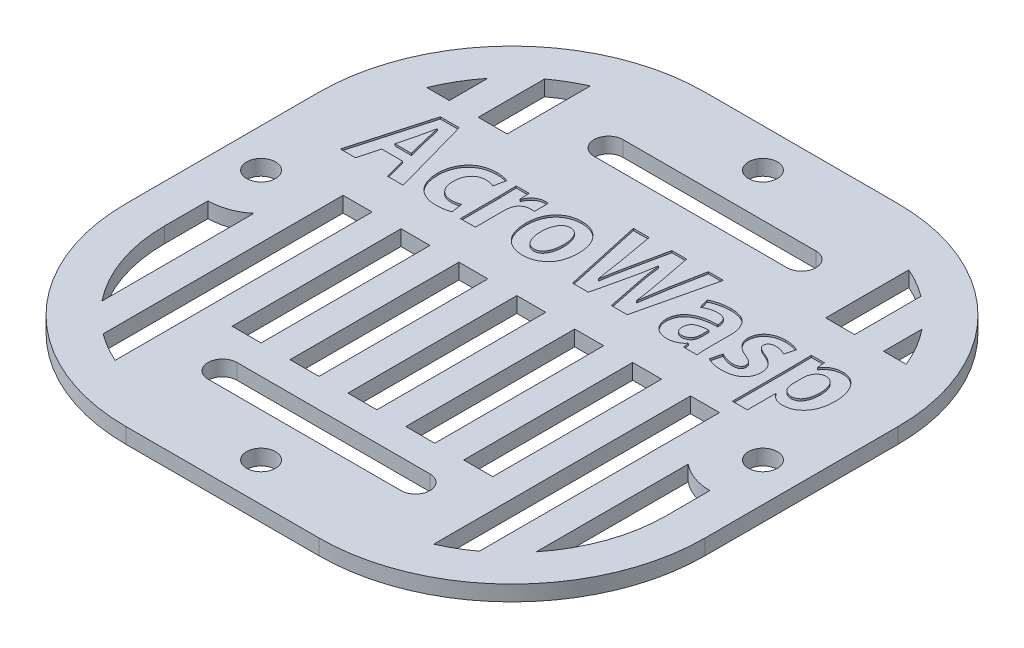
from build123d import *

# Parameters (mm, degrees)
SKETCH1_W           = 60
SKETCH1_H           = 60
SKETCH1_R           = 1.5
BOSS_EXTRUDE1_DEPTH = 1.6
FILLET1_R           = 20
CUT_EXTRUDE4_DEPTH  = 0.2
CUT_EXTRUDE5_DEPTH  = 43.456566182
SKETCH6_W           = 3
SKETCH6_H           = 17.5
CUT_EXTRUDE6_DEPTH  = 43.456566182


with BuildPart() as part:
    # Sketch1 → Boss-Extrude1 (new body)
    with BuildSketch(Plane(origin=(0, 0, 0), x_dir=(1, 0, 0), z_dir=(0, 1, 0))):
        Rectangle(SKETCH1_W, SKETCH1_H)
        with Locations(Location((0, 26, 0), (0, 0, 270))):
            Circle(SKETCH1_R, mode=Mode.SUBTRACT)
        with Locations(Location((26, 0, 0), (0, 0, 270))):
            Circle(SKETCH1_R, mode=Mode.SUBTRACT)
        with Locations(Location((0, -26, 0), (0, 0, 270))):
            Circle(SKETCH1_R, mode=Mode.SUBTRACT)
        with Locations(Location((-26, 0, 0), (0, 0, 270))):
            Circle(SKETCH1_R, mode=Mode.SUBTRACT)
    extrude(amount=BOSS_EXTRUDE1_DEPTH)

    # Fillet1
    fillet1_edges = [part.edges().sort_by_distance(p)[0] for p in [
        (30, 0.8, 30),
        (-30, 0.8, 30),
        (-30, 0.8, -30),
        (30, 0.8, -30),
    ]]
    fillet(fillet1_edges, radius=FILLET1_R)

    # Sketch3 → Cut-Extrude4 (cut)
    # profile 1 of 8: a face of its own
    with BuildSketch(Plane(origin=(0, 1.6, 0), x_dir=(1, 0, 0), z_dir=(0, 1, 0))):
        Polygon((-21.504968169, 14.077642703), (-23.798057112, 6.013453843), (-22.220243619, 6.013453843), (-21.662749519, 8.148761437), (-19.495885655, 8.148761437), (-18.917354041, 6.013453843), (-17.286946766, 6.013453843), (-19.548479439, 14.077642703), align=None)
        with BuildLine():
            add(Edge.make_bspline(
                [(-20.957992825, 11.170484561), (-20.927646904, 11.299420544), (-20.863997558, 11.569858573), (-20.77463979, 11.985947638), (-20.685352919, 12.407381413), (-20.629022947, 12.687192872), (-20.601850137, 12.822170101)],
                knots=[0, 0, 0, 0, 0.94066455, 1.973005993, 3.022205752, 4, 4, 4, 4], degree=3))
            Line((-20.601850137, 12.822170101), (-20.56879883, 12.823688916))
            add(Edge.make_bspline(
                [(-20.56879883, 12.823688916), (-20.540729217, 12.690792976), (-20.482333677, 12.414318547), (-20.394088746, 11.993835333), (-20.300600953, 11.571558398), (-20.233960393, 11.293699873), (-20.201620216, 11.158857159)],
                knots=[0, 0, 0, 0, 0.95601635, 1.988879968, 3.024018124, 4, 4, 4, 4], degree=3))
            Line((-20.201620216, 11.158857159), (-19.716779544, 9.30532087))
            Line((-19.716779544, 9.30532087), (-21.44185563, 9.30532087))
            Line((-21.44185563, 9.30532087), (-20.957992825, 11.170484561))
        make_face(mode=Mode.SUBTRACT)
    # profile 2 of 8: a face of its own
    with BuildSketch(Plane(origin=(0, 1.6, 0), x_dir=(1, 0, 0), z_dir=(0, 1, 0))):
        with BuildLine():
            add(Edge.make_bspline(
                [(-12.331967423, 11.799526418), (-12.367026711, 11.813005085), (-12.44191776, 11.841797212), (-12.563226101, 11.881263007), (-12.700695569, 11.916919834), (-12.907827572, 11.965344693), (-13.193570075, 12.010084786), (-13.429975078, 12.017732525), (-13.552933806, 12.021710259)],
                knots=[0, 0, 0, 0, 0.541847231, 1.15745385, 1.839115937, 2.590051948, 4.226421316, 6, 6, 6, 6], degree=3))
            add(Edge.make_bspline(
                [(-13.552933806, 12.021710259), (-13.670784384, 12.017224566), (-13.900814873, 12.00846902), (-14.234366238, 11.960429464), (-14.547245036, 11.887671279), (-14.839862013, 11.788926829), (-15.111679721, 11.662800294), (-15.361803904, 11.508869937), (-15.592284242, 11.330494125), (-15.797805721, 11.123647322), (-15.983884052, 10.89964816), (-16.143391144, 10.657196663), (-16.282221297, 10.402545631), (-16.393000723, 10.130548455), (-16.481262792, 9.844401217), (-16.545289484, 9.543493013), (-16.583427865, 9.227658003), (-16.590067829, 9.012227397), (-16.593463778, 8.902047375)],
                knots=[0, 0, 0, 0, 1.154617847, 2.253678444, 3.29503799, 4.29757116, 5.27348448, 6.223708663, 7.168982913, 8.121179864, 9.074245094, 10.016903677, 10.959562261, 11.910942048, 12.888561654, 13.88945568, 14.920581334, 16, 16, 16, 16], degree=3))
            add(Edge.make_bspline(
                [(-16.593463778, 8.902047375), (-16.590119527, 8.787804779), (-16.583590798, 8.56477753), (-16.545163792, 8.240604432), (-16.484877879, 7.936039909), (-16.401010678, 7.651198203), (-16.294657582, 7.385363073), (-16.165388425, 7.138967943), (-16.011556249, 6.913340653), (-15.836426608, 6.707886358), (-15.64218123, 6.523323359), (-15.428196305, 6.363772066), (-15.197969391, 6.228311411), (-14.950759086, 6.11596361), (-14.685597406, 6.029879969), (-14.404076466, 5.965757171), (-14.104829666, 5.927804031), (-13.900008225, 5.921208309), (-13.794897903, 5.917823514)],
                knots=[0, 0, 0, 0, 1.185825819, 2.314998766, 3.383718313, 4.404951788, 5.392442684, 6.351016225, 7.287101152, 8.220828758, 9.148225935, 10.062254741, 10.985112179, 11.915866123, 12.874902268, 13.873739595, 14.908845112, 16, 16, 16, 16], degree=3))
            add(Edge.make_bspline(
                [(-13.794897903, 5.917823514), (-13.718275502, 5.919159143), (-13.568938466, 5.921762283), (-13.351575194, 5.937083017), (-13.146361278, 5.96124093), (-12.954955961, 5.994352231), (-12.780638539, 6.033964761), (-12.625249579, 6.074274767), (-12.491859427, 6.118857894), (-12.411886168, 6.154179828), (-12.375070844, 6.170440119)],
                knots=[0, 0, 0, 0, 1.266754215, 2.468903584, 3.600631184, 4.681535172, 5.678465714, 6.555210452, 7.334897762, 8, 8, 8, 8], degree=3))
            Line((-12.375070844, 6.170440119), (-12.542342555, 7.343119494))
            add(Edge.make_bspline(
                [(-12.542342555, 7.343119494), (-12.607658351, 7.314523265), (-12.744103437, 7.254785574), (-12.971434071, 7.200564923), (-13.222496008, 7.163055675), (-13.398565997, 7.156788296), (-13.490540549, 7.153514374)],
                knots=[0, 0, 0, 0, 0.87676423, 1.831565681, 2.867264228, 4, 4, 4, 4], degree=3))
            add(Edge.make_bspline(
                [(-13.490540549, 7.153514374), (-13.546430541, 7.155483995), (-13.655629525, 7.159332279), (-13.814971853, 7.183121907), (-13.967164816, 7.218318848), (-14.109941083, 7.273309557), (-14.247465836, 7.337881526), (-14.374930523, 7.420881729), (-14.494364896, 7.517669214), (-14.605746196, 7.627089382), (-14.706778345, 7.750791671), (-14.794135047, 7.888297509), (-14.872047716, 8.036556504), (-14.931604609, 8.199270591), (-14.980434459, 8.373288774), (-15.016830097, 8.559479107), (-15.039918952, 8.75792818), (-15.043809036, 8.894374281), (-15.04580663, 8.964440633)],
                knots=[0, 0, 0, 0, 0.998859532, 1.951591722, 2.875231318, 3.78469887, 4.680917394, 5.586353418, 6.495459316, 7.425131778, 8.372498858, 9.343309935, 10.332783696, 11.360046324, 12.433641722, 13.561024455, 14.747563201, 16, 16, 16, 16], degree=3))
            add(Edge.make_bspline(
                [(-15.04580663, 8.964440633), (-15.044201528, 9.028918274), (-15.041059545, 9.155133073), (-15.020652075, 9.340214302), (-14.989494647, 9.516398153), (-14.94468971, 9.683677517), (-14.889238939, 9.84267777), (-14.818201927, 9.991588342), (-14.737981373, 10.13323608), (-14.643427965, 10.263215887), (-14.539053847, 10.383218229), (-14.42113427, 10.486492147), (-14.293172818, 10.57596112), (-14.155380022, 10.651088891), (-14.005257301, 10.706784267), (-13.846449939, 10.749757915), (-13.676599183, 10.777465481), (-13.55963091, 10.783120536), (-13.499671269, 10.7860194)],
                knots=[0, 0, 0, 0, 1.152800695, 2.256604074, 3.325842897, 4.34888118, 5.35009528, 6.332019554, 7.295036531, 8.256642933, 9.201201668, 10.132957584, 11.051374066, 11.988807583, 12.930444073, 13.907328497, 14.927266108, 16, 16, 16, 16], degree=3))
            add(Edge.make_bspline(
                [(-13.499671269, 10.7860194), (-13.448921721, 10.783868906), (-13.350859895, 10.77971357), (-13.209231096, 10.767437884), (-13.078656779, 10.751197758), (-12.958838915, 10.729632409), (-12.849825723, 10.704633111), (-12.751392903, 10.673548219), (-12.66304731, 10.640068949), (-12.610171212, 10.611076837), (-12.585077419, 10.59731784)],
                knots=[0, 0, 0, 0, 1.29360923, 2.499602188, 3.619770261, 4.643630639, 5.599445193, 6.465756666, 7.271883015, 8, 8, 8, 8], degree=3))
            Line((-12.585077419, 10.59731784), (-12.331967423, 11.799526418))
        make_face()
    # profile 3 of 8: a face of its own
    with BuildSketch(Plane(origin=(0, 1.6, 0), x_dir=(1, 0, 0), z_dir=(0, 1, 0))):
        with BuildLine():
            Line((-9.985012579, 10.815025488), (-10.047697116, 11.811703684))
            Line((-10.047697116, 11.811703684), (-11.374723418, 11.811703684))
            add(Edge.make_bspline(
                [(-11.374723418, 11.811703684), (-11.369674401, 11.679313156), (-11.359209717, 11.404918142), (-11.348414166, 11.055394196), (-11.339241343, 10.758666572), (-11.337595045, 10.520715925), (-11.333240718, 10.27014641), (-11.333853916, 10.099188521), (-11.334168692, 10.011429932)],
                knots=[0, 0, 0, 0, 1.324207679, 2.744576904, 3.495229973, 4.291304775, 5.122867722, 6, 6, 6, 6], degree=3))
            Line((-11.334168692, 10.011429932), (-11.332648391, 5.984196601))
            Line((-11.332648391, 5.984196601), (-9.786511544, 5.984196601))
            Line((-9.786511544, 5.984196601), (-9.786511544, 9.013598507))
            add(Edge.make_bspline(
                [(-9.786511544, 9.013598507), (-9.784802425, 9.073856879), (-9.781487131, 9.190744115), (-9.763083833, 9.359972233), (-9.734517254, 9.517243333), (-9.695433093, 9.662649472), (-9.644277895, 9.795572008), (-9.586579073, 9.918619205), (-9.513186337, 10.026944765), (-9.433097706, 10.12532536), (-9.342897047, 10.209636204), (-9.247604267, 10.28435286), (-9.14543089, 10.345970995), (-9.038079117, 10.399113995), (-8.923438909, 10.438464563), (-8.802890368, 10.46510738), (-8.676655602, 10.483085071), (-8.590452717, 10.484156356), (-8.546255325, 10.484705619)],
                knots=[0, 0, 0, 0, 1.328993375, 2.577938255, 3.749595128, 4.851401761, 5.892294362, 6.887899519, 7.84040204, 8.769965346, 9.679936652, 10.557066843, 11.435764995, 12.306307666, 13.19428498, 14.100673707, 15.026189549, 16, 16, 16, 16], degree=3))
            add(Edge.make_bspline(
                [(-8.546255325, 10.484705619), (-8.474088763, 10.483872883), (-8.339995824, 10.482325575), (-8.207304494, 10.463133231), (-8.146025403, 10.454269883)],
                knots=[0, 0, 0, 0, 1.076366321, 2, 2, 2, 2], degree=3))
            Line((-8.146025403, 10.454269883), (-8.145585512, 11.904178981))
            add(Edge.make_bspline(
                [(-8.145585512, 11.904178981), (-8.19836489, 11.913284488), (-8.313272538, 11.933108374), (-8.429922489, 11.933327921), (-8.492992788, 11.933446626)],
                knots=[0, 0, 0, 0, 0.918639949, 2, 2, 2, 2], degree=3))
            add(Edge.make_bspline(
                [(-8.492992788, 11.933446626), (-8.563790768, 11.929640269), (-8.706218399, 11.92198284), (-8.917869735, 11.868128135), (-9.125076547, 11.77733475), (-9.328294943, 11.655138865), (-9.519217121, 11.497409055), (-9.686201359, 11.301290577), (-9.832742637, 11.073469274), (-9.905641975, 10.902927282), (-9.943255582, 10.814933348)],
                knots=[0, 0, 0, 0, 0.873024494, 1.756304479, 2.675727742, 3.655517484, 4.673026258, 5.715548879, 6.821300036, 8, 8, 8, 8], degree=3))
            Line((-9.943255582, 10.814933348), (-9.985012579, 10.815025488))
        make_face()
    # profile 4 of 8: a face of its own
    with BuildSketch(Plane(origin=(0, 1.6, 0), x_dir=(1, 0, 0), z_dir=(0, 1, 0))):
        with BuildLine():
            add(Edge.make_bspline(
                [(-4.75949254, 12.027354542), (-4.859740427, 12.024283231), (-5.056271276, 12.018262083), (-5.343352603, 11.977934936), (-5.615206017, 11.913801515), (-5.87379838, 11.827828399), (-6.115730851, 11.712411158), (-6.34443716, 11.574721737), (-6.558751646, 11.412647191), (-6.756440752, 11.225525199), (-6.934797029, 11.014617578), (-7.092586569, 10.782634618), (-7.225467699, 10.527509284), (-7.334239511, 10.251292582), (-7.422017572, 9.954065301), (-7.482358254, 9.634318769), (-7.525041001, 9.293742953), (-7.532146741, 9.058928405), (-7.535788908, 8.938570258)],
                knots=[0, 0, 0, 0, 1.027541305, 2.01444209, 2.965455667, 3.887964877, 4.802126615, 5.70729655, 6.620422444, 7.551044475, 8.491838489, 9.446611953, 10.4211747, 11.434103498, 12.48554143, 13.593051636, 14.766278128, 16, 16, 16, 16], degree=3))
            add(Edge.make_bspline(
                [(-7.535788908, 8.938570258), (-7.531815992, 8.821797833), (-7.524074233, 8.594251048), (-7.486015579, 8.263477557), (-7.425724685, 7.952817022), (-7.341703714, 7.662698733), (-7.23744174, 7.391923337), (-7.109182217, 7.142223561), (-6.95742892, 6.913672949), (-6.783978444, 6.706826047), (-6.591443161, 6.522469755), (-6.384549041, 6.360347344), (-6.161563389, 6.223187917), (-5.922951554, 6.113028834), (-5.6702912, 6.022741416), (-5.401351246, 5.962610659), (-5.118460092, 5.920704874), (-4.92456383, 5.915776471), (-4.825486666, 5.913258154)],
                knots=[0, 0, 0, 0, 1.223897542, 2.384929084, 3.484665604, 4.536017932, 5.545769523, 6.520427524, 7.47127239, 8.414510255, 9.343031883, 10.259533357, 11.163839298, 12.079307538, 13.00892387, 13.969450143, 14.96242909, 16, 16, 16, 16], degree=3))
            add(Edge.make_bspline(
                [(-4.825486666, 5.913258154), (-4.739681686, 5.914202967), (-4.569526347, 5.916076575), (-4.317505352, 5.946826148), (-4.072973703, 6.002884643), (-3.834634617, 6.07774671), (-3.604260404, 6.180154123), (-3.381150243, 6.305173012), (-3.163640124, 6.451980758), (-2.955125155, 6.621782471), (-2.760175027, 6.8173951), (-2.590102986, 7.045512886), (-2.446004569, 7.302847383), (-2.325175705, 7.588627949), (-2.23004241, 7.903541423), (-2.160040262, 8.247494191), (-2.10995089, 8.619672833), (-2.099356736, 8.87803772), (-2.093879409, 9.011616023)],
                knots=[0, 0, 0, 0, 0.884174072, 1.753359075, 2.610998878, 3.46768153, 4.324683351, 5.204936043, 6.101305348, 7.026692402, 7.9733639, 8.940823434, 9.950119057, 11.006907355, 12.133439191, 13.335476165, 14.622403465, 16, 16, 16, 16], degree=3))
            add(Edge.make_bspline(
                [(-2.093879409, 9.011616023), (-2.096802784, 9.122297876), (-2.102503414, 9.338129308), (-2.138389172, 9.653490807), (-2.193862861, 9.951805497), (-2.271166154, 10.233791486), (-2.37209246, 10.498025457), (-2.494008176, 10.745889571), (-2.637789048, 10.976784694), (-2.801631572, 11.190158615), (-2.985882392, 11.382009071), (-3.187434696, 11.550768695), (-3.407295519, 11.693520761), (-3.6444849, 11.810666173), (-3.898822798, 11.90452954), (-4.171112735, 11.9702013), (-4.459928706, 12.013841392), (-4.65843783, 12.022065763), (-4.760049834, 12.026275619)],
                knots=[0, 0, 0, 0, 1.172178488, 2.285767329, 3.357353606, 4.383142343, 5.37790515, 6.348569651, 7.304145378, 8.254071287, 9.192580156, 10.115693567, 11.032123006, 11.961934424, 12.912057809, 13.897126048, 14.92358985, 16, 16, 16, 16], degree=3))
            Line((-4.760049834, 12.026275619), (-4.75949254, 12.027354542))
        make_face()
        with BuildLine():
            add(Edge.make_bspline(
                [(-3.638494469, 8.981149079), (-3.639775353, 8.914672143), (-3.642272237, 8.78508571), (-3.658466886, 8.595255607), (-3.680425774, 8.414278696), (-3.712396999, 8.240840021), (-3.754678472, 8.075595454), (-3.80717122, 7.918439477), (-3.865486763, 7.768545999), (-3.935333234, 7.629027046), (-4.01383449, 7.501356372), (-4.100370456, 7.38798812), (-4.195331586, 7.290580998), (-4.299770958, 7.210384474), (-4.413955912, 7.147588739), (-4.536161424, 7.100253455), (-4.666774611, 7.068963412), (-4.756836605, 7.062468291), (-4.802659864, 7.059163594)],
                knots=[0, 0, 0, 0, 1.283122856, 2.501248181, 3.675693063, 4.801111487, 5.90306991, 6.965153204, 7.997944625, 9.005120804, 9.972479457, 10.88710922, 11.752618092, 12.590832926, 13.419210094, 14.259310164, 15.114342493, 16, 16, 16, 16], degree=3))
            add(Edge.make_bspline(
                [(-4.802659864, 7.059163594), (-4.849970315, 7.062602705), (-4.942371422, 7.069319567), (-5.076873116, 7.09834287), (-5.201675053, 7.145685742), (-5.317420107, 7.209371189), (-5.425114256, 7.287245644), (-5.523048397, 7.382886568), (-5.611710963, 7.495037698), (-5.689900607, 7.622924933), (-5.758579076, 7.762791451), (-5.821689157, 7.910074118), (-5.873993112, 8.066741431), (-5.91341577, 8.232117906), (-5.947795087, 8.405056166), (-5.971984515, 8.58594919), (-5.985575087, 8.775525392), (-5.98726688, 8.904561696), (-5.98813176, 8.97052778)],
                knots=[0, 0, 0, 0, 0.911055033, 1.779363595, 2.63415358, 3.467599306, 4.312094286, 5.180950159, 6.090072498, 7.053374358, 8.056326761, 9.083167907, 10.131542306, 11.226494184, 12.349015479, 13.51979452, 14.732066572, 16, 16, 16, 16], degree=3))
            add(Edge.make_bspline(
                [(-5.98813176, 8.97052778), (-5.986114628, 9.085845057), (-5.982141116, 9.313006445), (-5.932476171, 9.645497318), (-5.848162176, 9.962647109), (-5.749610793, 10.21247578), (-5.651657899, 10.397659243), (-5.564068174, 10.518445821), (-5.466013694, 10.624215166), (-5.354298247, 10.711093874), (-5.230573971, 10.78062457), (-5.095176607, 10.832173122), (-4.947936816, 10.868271722), (-4.844973706, 10.876260558), (-4.792007357, 10.88037018)],
                knots=[0, 0, 0, 0, 1.65391609, 3.258018954, 4.81028456, 6.355517439, 7.101557024, 7.81077486, 8.490611841, 9.164890731, 9.833129237, 10.519947043, 11.238630196, 12, 12, 12, 12], degree=3))
            add(Edge.make_bspline(
                [(-4.792007357, 10.88037018), (-4.742599428, 10.876152715), (-4.646791383, 10.867974532), (-4.509155815, 10.833316978), (-4.381947076, 10.78325152), (-4.264398959, 10.715757874), (-4.159341665, 10.62927815), (-4.063463322, 10.527183213), (-3.97844272, 10.408512329), (-3.881472513, 10.226046291), (-3.782923509, 9.978340412), (-3.696494485, 9.662002023), (-3.64784202, 9.326634302), (-3.642661595, 9.096990142), (-3.64001477, 8.979658501)],
                knots=[0, 0, 0, 0, 0.723780441, 1.403499192, 2.065726992, 2.716821306, 3.375678756, 4.047057085, 4.75896833, 5.502158925, 7.062054522, 8.644794005, 10.285731159, 12, 12, 12, 12], degree=3))
            Line((-3.64001477, 8.979658501), (-3.638494469, 8.981149079))
        make_face(mode=Mode.SUBTRACT)
    # profile 5 of 8: a face of its own
    with BuildSketch(Plane(origin=(0, 1.6, 0), x_dir=(1, 0, 0), z_dir=(0, 1, 0))):
        with BuildLine():
            add(Edge.make_bspline(
                [(5.622599006, 10.624531667), (5.580864038, 10.382171294), (5.498299644, 9.902709143), (5.380681197, 9.187612931), (5.269094547, 8.477774815), (5.203856319, 8.004303484), (5.171130643, 7.766794443)],
                knots=[0, 0, 0, 0, 1.019964245, 2.017797891, 3.005661186, 4, 4, 4, 4], degree=3))
            Line((5.171130643, 7.766794443), (5.141060493, 7.768048728))
            add(Edge.make_bspline(
                [(5.141060493, 7.768048728), (5.112883082, 8.002172037), (5.05686925, 8.467585408), (4.948606666, 9.162114521), (4.831817266, 9.857203955), (4.744765861, 10.320993117), (4.700898531, 10.55470781)],
                knots=[0, 0, 0, 0, 1.002730177, 1.993325802, 2.988787831, 4, 4, 4, 4], degree=3))
            Line((4.700898531, 10.55470781), (4.020960039, 14.068783942))
            Line((4.020960039, 14.068783942), (2.492598672, 14.068783942))
            Line((2.492598672, 14.068783942), (1.759822675, 10.597594258))
            add(Edge.make_bspline(
                [(1.759822675, 10.597594258), (1.70562088, 10.350215972), (1.598908028, 9.863175961), (1.463128594, 9.139766794), (1.336518544, 8.437904473), (1.269026088, 7.974976052), (1.235790049, 7.747011215)],
                knots=[0, 0, 0, 0, 1.048193848, 2.063690999, 3.046482464, 4, 4, 4, 4], degree=3))
            Line((1.235790049, 7.747011215), (1.205006562, 7.747011215))
            add(Edge.make_bspline(
                [(1.205006562, 7.747011215), (1.174210231, 7.970284746), (1.110957769, 8.428865359), (1.003813888, 9.128655285), (0.890552737, 9.848881762), (0.806293897, 10.333144114), (0.76403615, 10.576012825)],
                knots=[0, 0, 0, 0, 0.944566409, 1.940041169, 2.966883251, 4, 4, 4, 4], degree=3))
            Line((0.76403615, 10.576012825), (0.147715479, 14.068783942))
            Line((0.147715479, 14.068783942), (-1.495818693, 14.068783942))
            Line((-1.495818693, 14.068783942), (0.273334222, 6.006087147))
            Line((0.273334222, 6.006087147), (1.906377874, 6.006087147))
            Line((1.906377874, 6.006087147), (2.691495015, 9.40897476))
            add(Edge.make_bspline(
                [(2.691495015, 9.40897476), (2.738814913, 9.619736722), (2.833144295, 10.039878069), (2.958246638, 10.676187267), (3.071507008, 11.324249664), (3.138801237, 11.762373618), (3.173024611, 11.985187376)],
                knots=[0, 0, 0, 0, 0.988746274, 1.971006476, 2.968128379, 4, 4, 4, 4], degree=3))
            Line((3.173024611, 11.985187376), (3.193969985, 11.986070132))
            add(Edge.make_bspline(
                [(3.193969985, 11.986070132), (3.220546676, 11.761953423), (3.272712442, 11.3220484), (3.366052394, 10.672102757), (3.473867325, 10.036613555), (3.559400343, 9.618078077), (3.602168481, 9.408802371)],
                knots=[0, 0, 0, 0, 1.03744887, 2.036345133, 3.018135183, 4, 4, 4, 4], degree=3))
            Line((3.602168481, 9.408802371), (4.293133981, 6.006087147))
            Line((4.293133981, 6.006087147), (5.936645862, 6.006087147))
            Line((5.936645862, 6.006087147), (7.841863457, 14.068783942))
            Line((7.841863457, 14.068783942), (6.282097404, 14.068783942))
            Line((6.282097404, 14.068783942), (5.622599006, 10.624531667))
        make_face()
    # profile 6 of 8: a face of its own
    with BuildSketch(Plane(origin=(0, 1.6, 0), x_dir=(1, 0, 0), z_dir=(0, 1, 0))):
        with BuildLine():
            add(Edge.make_bspline(
                [(9.055440852, 10.451303588), (9.104926697, 10.482092264), (9.205874932, 10.544899365), (9.36858062, 10.623479987), (9.540361276, 10.696264812), (9.721351764, 10.758039825), (9.909627149, 10.807517514), (10.100869615, 10.846943214), (10.296069458, 10.867559565), (10.426835418, 10.872028194), (10.492818987, 10.874283033)],
                knots=[0, 0, 0, 0, 0.92116327, 1.879119297, 2.853562296, 3.87091793, 4.900348678, 5.930904215, 6.955949054, 8, 8, 8, 8], degree=3))
            add(Edge.make_bspline(
                [(10.492818987, 10.874283033), (10.541584523, 10.873165214), (10.635864284, 10.871004105), (10.770447661, 10.853188387), (10.893806824, 10.830468128), (11.003440096, 10.794517823), (11.10263276, 10.752930324), (11.187789677, 10.699306638), (11.261800823, 10.63734472), (11.342015183, 10.541003016), (11.42171958, 10.403001224), (11.484534286, 10.217213572), (11.522898209, 10.011495206), (11.52201078, 9.867546814), (11.521546845, 9.792292637)],
                knots=[0, 0, 0, 0, 1.015501891, 1.963297894, 2.825560386, 3.624409854, 4.362726652, 5.060679176, 5.712965577, 6.365251979, 7.663128898, 9.006844189, 10.435220624, 12, 12, 12, 12], degree=3))
            add(Edge.make_bspline(
                [(11.521546845, 9.792292637), (11.407875614, 9.791004006), (11.185331775, 9.788481144), (10.859642414, 9.763735805), (10.550126063, 9.723143789), (10.257135145, 9.665813773), (9.980867398, 9.590527507), (9.719458901, 9.502102142), (9.475090363, 9.392960592), (9.247160199, 9.269322104), (9.038366733, 9.129272078), (8.8580271, 8.966605937), (8.703075341, 8.786624628), (8.576732413, 8.587250957), (8.474884088, 8.370093143), (8.400761222, 8.134243012), (8.35266471, 7.87975272), (8.343962249, 7.703603775), (8.339490704, 7.613093979)],
                knots=[0, 0, 0, 0, 1.257977162, 2.462848908, 3.612643946, 4.711551888, 5.764370023, 6.780002296, 7.762808841, 8.722621342, 9.647663435, 10.538241288, 11.402392885, 12.268366511, 13.142456214, 14.049813262, 14.997944576, 16, 16, 16, 16], degree=3))
            add(Edge.make_bspline(
                [(8.339490704, 7.613093979), (8.341360133, 7.554155697), (8.345034488, 7.438312756), (8.370560795, 7.268849597), (8.407967074, 7.106031838), (8.461795054, 6.951582364), (8.527194461, 6.802915073), (8.609561103, 6.663471826), (8.706910889, 6.531852271), (8.815137061, 6.406822289), (8.938714329, 6.294663743), (9.073310771, 6.195246999), (9.218690909, 6.10906387), (9.376153216, 6.039219047), (9.544672775, 5.984797211), (9.723761043, 5.94327837), (9.914362156, 5.917719754), (10.045339669, 5.911748702), (10.112372294, 5.908692794)],
                knots=[0, 0, 0, 0, 1.027322353, 2.019197713, 2.982425992, 3.936187424, 4.866532966, 5.810028182, 6.752901381, 7.718036202, 8.688384618, 9.655988284, 10.631321951, 11.629016196, 12.652677156, 13.714668757, 14.830396542, 16, 16, 16, 16], degree=3))
            add(Edge.make_bspline(
                [(10.112372294, 5.908692794), (10.191113075, 5.911194191), (10.345763681, 5.916107052), (10.572400173, 5.94999899), (10.787625262, 6.006372604), (10.9910523, 6.083874222), (11.179500307, 6.182583483), (11.351692967, 6.300410892), (11.50626659, 6.438259293), (11.593386833, 6.544586529), (11.63720264, 6.598062202)],
                knots=[0, 0, 0, 0, 1.089521257, 2.139871092, 3.163177725, 4.163102539, 5.145903192, 6.1000057, 7.044426644, 8, 8, 8, 8], degree=3))
            Line((11.63720264, 6.598062202), (11.670169238, 6.598187036))
            Line((11.670169238, 6.598187036), (11.765667302, 6.018612166))
            Line((11.765667302, 6.018612166), (13.176179361, 6.018612166))
            add(Edge.make_bspline(
                [(13.176179361, 6.018612166), (13.168575631, 6.063590073), (13.152790256, 6.156964399), (13.13532698, 6.303140854), (13.119497959, 6.459850576), (13.106492334, 6.687231487), (13.09231675, 6.987980129), (13.091122141, 7.233131621), (13.090509008, 7.358955588)],
                knots=[0, 0, 0, 0, 0.610548939, 1.267502157, 1.970203817, 2.718660699, 4.315853085, 6, 6, 6, 6], degree=3))
            Line((13.090509008, 7.358955588), (13.092029308, 9.488546078))
            add(Edge.make_bspline(
                [(13.092029308, 9.488546078), (13.092077976, 9.572065805), (13.092173787, 9.736487911), (13.074097765, 9.978479768), (13.038670054, 10.210234657), (12.989674943, 10.432242743), (12.920058515, 10.642436233), (12.836934208, 10.843135996), (12.73510698, 11.032568098), (12.619704886, 11.213165793), (12.480254549, 11.378346208), (12.314006905, 11.522466838), (12.121516319, 11.644904473), (11.90297908, 11.744893692), (11.659621842, 11.825572797), (11.389780392, 11.883994511), (11.094445533, 11.92202994), (10.888603039, 11.929550377), (10.781958474, 11.933446626)],
                knots=[0, 0, 0, 0, 1.037939004, 2.043351001, 3.012684027, 3.950348011, 4.865589174, 5.761446226, 6.647171701, 7.535608735, 8.421289321, 9.324087164, 10.259862385, 11.247218489, 12.30401033, 13.440682476, 14.674047819, 16, 16, 16, 16], degree=3))
            add(Edge.make_bspline(
                [(10.781958474, 11.933446626), (10.672310576, 11.930822688), (10.458681138, 11.92571041), (10.148210257, 11.89441285), (9.856724306, 11.84831356), (9.586754063, 11.784031847), (9.341060939, 11.70961942), (9.120393554, 11.632172722), (8.926834698, 11.551961723), (8.810816888, 11.489456062), (8.756460279, 11.46017094)],
                knots=[0, 0, 0, 0, 1.252902983, 2.441058744, 3.56267823, 4.62278865, 5.609386748, 6.494886694, 7.294825038, 8, 8, 8, 8], degree=3))
            Line((8.756460279, 11.46017094), (9.055440852, 10.451303588))
        make_face()
        with BuildLine():
            add(Edge.make_bspline(
                [(11.564155389, 7.983791726), (11.56064248, 7.938804806), (11.553850848, 7.851829973), (11.535129287, 7.726359076), (11.503930696, 7.612126179), (11.466658805, 7.507542143), (11.418792162, 7.413683092), (11.362721056, 7.329327349), (11.296331125, 7.255304712), (11.198157011, 7.172508231), (11.069532204, 7.090464257), (10.913148007, 7.019174055), (10.75987199, 6.972071652), (10.65697621, 6.969235295), (10.606952995, 6.967856387)],
                knots=[0, 0, 0, 0, 1.043926595, 2.0182609, 2.929185394, 3.779426585, 4.582434006, 5.360352114, 6.116635953, 6.874011636, 8.325857533, 9.628293333, 10.846984866, 12, 12, 12, 12], degree=3))
            add(Edge.make_bspline(
                [(10.606952995, 6.967856387), (10.559512804, 6.969438844), (10.466165259, 6.972552626), (10.332555101, 7.011001307), (10.208999514, 7.071156315), (10.09858135, 7.157051537), (10.004437712, 7.269756291), (9.939884351, 7.413886573), (9.896644504, 7.583250536), (9.890441272, 7.706123874), (9.887147851, 7.771359803)],
                knots=[0, 0, 0, 0, 0.932689269, 1.835242495, 2.716319968, 3.628517603, 4.573510817, 5.580053048, 6.715201435, 8, 8, 8, 8], degree=3))
            add(Edge.make_bspline(
                [(9.887147851, 7.771359803), (9.890276703, 7.82177979), (9.896338119, 7.919456672), (9.928577512, 8.057800221), (9.96963404, 8.185427485), (10.030532682, 8.298338771), (10.103245796, 8.4012699), (10.19495258, 8.487231463), (10.298258682, 8.564188815), (10.458760013, 8.645371699), (10.678058424, 8.723254441), (10.956955644, 8.791181196), (11.254236695, 8.82777171), (11.458045301, 8.828584504), (11.562635088, 8.82900161)],
                knots=[0, 0, 0, 0, 0.812232766, 1.573510204, 2.281488938, 2.964950378, 3.63174977, 4.302044204, 4.980259673, 5.700253563, 7.189246091, 8.719149585, 10.31634467, 12, 12, 12, 12], degree=3))
            Line((11.562635088, 8.82900161), (11.564155389, 7.983791726))
        make_face(mode=Mode.SUBTRACT)
    # profile 7 of 8: a face of its own
    with BuildSketch(Plane(origin=(0, 1.6, 0), x_dir=(1, 0, 0), z_dir=(0, 1, 0))):
        with BuildLine():
            add(Edge.make_bspline(
                [(14.145322728, 6.311416424), (14.196377553, 6.281463925), (14.301789423, 6.219621603), (14.476543951, 6.148315098), (14.66475126, 6.079540088), (14.868523567, 6.023476257), (15.083673484, 5.975752405), (15.307440988, 5.942786244), (15.538192568, 5.922747562), (15.694245714, 5.919480868), (15.773419088, 5.917823514)],
                knots=[0, 0, 0, 0, 0.83761196, 1.729400559, 2.668252281, 3.676193025, 4.720774259, 5.789020092, 6.87826204, 8, 8, 8, 8], degree=3))
            add(Edge.make_bspline(
                [(15.773419088, 5.917823514), (15.863271012, 5.920186407), (16.037765413, 5.924775196), (16.291467176, 5.951102395), (16.529105226, 5.991493201), (16.750677535, 6.047480898), (16.955966104, 6.119199819), (17.145423766, 6.205620891), (17.318573556, 6.307877142), (17.474654533, 6.42550106), (17.612413404, 6.556552508), (17.734982179, 6.69681045), (17.835127625, 6.850935084), (17.91972243, 7.014236033), (17.985603319, 7.189426382), (18.032037284, 7.375306591), (18.061971693, 7.572067929), (18.066137488, 7.706826425), (18.068273541, 7.775925164)],
                knots=[0, 0, 0, 0, 1.294448016, 2.513846346, 3.670773034, 4.764320961, 5.802019244, 6.79930617, 7.759297293, 8.693207164, 9.608170021, 10.494314425, 11.369880064, 12.249036721, 13.139389433, 14.05924175, 15.004857203, 16, 16, 16, 16], degree=3))
            add(Edge.make_bspline(
                [(18.068273541, 7.775925164), (18.068146278, 7.824657012), (18.067896363, 7.920355097), (18.052263528, 8.062037572), (18.023897551, 8.198437418), (17.989301535, 8.331964584), (17.936612524, 8.458357921), (17.878799165, 8.582311447), (17.806182417, 8.700198725), (17.721576176, 8.812780837), (17.627876852, 8.922447208), (17.521803234, 9.026585771), (17.404303693, 9.12508969), (17.275977956, 9.220034456), (17.13575166, 9.309262293), (16.984519339, 9.394857306), (16.821819403, 9.47536536), (16.708041332, 9.523988956), (16.649968269, 9.548806754)],
                knots=[0, 0, 0, 0, 0.962486949, 1.890101854, 2.810103424, 3.714741646, 4.610057768, 5.511190598, 6.415440003, 7.339636668, 8.292049338, 9.263110372, 10.273172223, 11.319680428, 12.415205866, 13.555314351, 14.752216631, 16, 16, 16, 16], degree=3))
            add(Edge.make_bspline(
                [(16.649968269, 9.548806754), (16.570558551, 9.581620751), (16.423627735, 9.642336082), (16.223542738, 9.736136167), (16.062651064, 9.827114408), (15.933688632, 9.911613059), (15.839574771, 10.003043875), (15.772851484, 10.100675612), (15.733914067, 10.208967192), (15.731849612, 10.284036855), (15.730809058, 10.321874434)],
                knots=[0, 0, 0, 0, 1.614286799, 2.986894832, 4.147698299, 5.086165248, 5.874638583, 6.596229827, 7.29245366, 8, 8, 8, 8], degree=3))
            add(Edge.make_bspline(
                [(15.730809058, 10.321874434), (15.733192248, 10.360176258), (15.737873537, 10.435412334), (15.773704488, 10.542983435), (15.835569127, 10.638356556), (15.920506649, 10.721390438), (16.029287984, 10.788154701), (16.15921799, 10.839391463), (16.312101383, 10.866225741), (16.42059717, 10.871494915), (16.478006363, 10.874283033)],
                knots=[0, 0, 0, 0, 0.881322943, 1.731178161, 2.577168917, 3.477799905, 4.443891127, 5.498430146, 6.676325488, 8, 8, 8, 8], degree=3))
            add(Edge.make_bspline(
                [(16.478006363, 10.874283033), (16.532305973, 10.871772547), (16.639649609, 10.866809627), (16.797385408, 10.850292169), (16.947812886, 10.81624977), (17.091493602, 10.776638778), (17.225112362, 10.726242474), (17.350189415, 10.679539531), (17.462023503, 10.6270562), (17.531248197, 10.589514269), (17.564562119, 10.571447465)],
                knots=[0, 0, 0, 0, 1.145139439, 2.263799542, 3.334746207, 4.390066399, 5.400675127, 6.341237668, 7.2017317, 8, 8, 8, 8], degree=3))
            Line((17.564562119, 10.571447465), (17.852497849, 11.62525211))
            add(Edge.make_bspline(
                [(17.852497849, 11.62525211), (17.808484668, 11.646303366), (17.717216071, 11.689956621), (17.570481772, 11.748003738), (17.408879006, 11.798578248), (17.234729264, 11.84648933), (17.047673386, 11.884344173), (16.848864134, 11.910872939), (16.639692279, 11.930309507), (16.496314891, 11.932387354), (16.42322204, 11.933446626)],
                knots=[0, 0, 0, 0, 0.793782206, 1.646038456, 2.564925853, 3.548079898, 4.584144923, 5.667469512, 6.810891258, 8, 8, 8, 8], degree=3))
            add(Edge.make_bspline(
                [(16.42322204, 11.933446626), (16.34247724, 11.931222247), (16.184582103, 11.926872509), (15.954867974, 11.898218547), (15.738594141, 11.85794009), (15.535105899, 11.803130692), (15.345317078, 11.732215171), (15.1693397, 11.644761375), (15.006481382, 11.543747079), (14.857726495, 11.428819713), (14.725326491, 11.300537456), (14.608892953, 11.163023709), (14.509060922, 11.016535685), (14.427904257, 10.859511308), (14.363856574, 10.693709338), (14.318306401, 10.518030639), (14.28893611, 10.333984638), (14.283371003, 10.207849241), (14.280546264, 10.143825382)],
                knots=[0, 0, 0, 0, 1.238305518, 2.421486237, 3.5461187, 4.61066152, 5.649707088, 6.648348897, 7.619889882, 8.584803378, 9.525735187, 10.442256057, 11.344296488, 12.23865353, 13.147513515, 14.064694656, 15.017676866, 16, 16, 16, 16], degree=3))
            add(Edge.make_bspline(
                [(14.280546264, 10.143825382), (14.283570668, 10.063785848), (14.289614043, 9.90385057), (14.354767793, 9.667280549), (14.461039871, 9.437884608), (14.584152017, 9.254708392), (14.704711334, 9.11343775), (14.813016687, 9.010107845), (14.932692862, 8.9072602), (15.069844478, 8.810488857), (15.219341918, 8.714955975), (15.383639434, 8.623379716), (15.561845336, 8.534875576), (15.687415306, 8.480920257), (15.752114073, 8.453120277)],
                knots=[0, 0, 0, 0, 1.205031059, 2.40789731, 3.671482689, 5.006580914, 5.722947508, 6.46981472, 7.262559811, 8.101501413, 8.999551731, 9.938382947, 10.93777087, 12, 12, 12, 12], degree=3))
            add(Edge.make_bspline(
                [(15.752114073, 8.453120277), (15.8275972, 8.422101231), (15.968138698, 8.364347088), (16.157742078, 8.270426408), (16.311235416, 8.178349785), (16.43216785, 8.086812287), (16.519134855, 7.987306852), (16.581591468, 7.881178272), (16.61600121, 7.763335829), (16.617335258, 7.681781036), (16.618010746, 7.640486141)],
                knots=[0, 0, 0, 0, 1.539706787, 2.866769117, 3.98803217, 4.914911995, 5.715441686, 6.465811877, 7.223170887, 8, 8, 8, 8], degree=3))
            add(Edge.make_bspline(
                [(16.618010746, 7.640486141), (16.61603677, 7.597558073), (16.612235526, 7.514892384), (16.572166411, 7.397405108), (16.505129197, 7.2955824), (16.412469977, 7.207833899), (16.292610419, 7.139232385), (16.146095746, 7.091767341), (15.974008857, 7.061361884), (15.850161994, 7.057943974), (15.784071595, 7.05612002)],
                knots=[0, 0, 0, 0, 0.894036243, 1.721627017, 2.5562417, 3.418119501, 4.363067525, 5.415159204, 6.6206097, 8, 8, 8, 8], degree=3))
            add(Edge.make_bspline(
                [(15.784071595, 7.05612002), (15.722103487, 7.058676857), (15.598242011, 7.063787446), (15.412714561, 7.089491591), (15.226755467, 7.126669058), (15.044573809, 7.180498276), (14.870447568, 7.240117643), (14.710826796, 7.30437375), (14.566595153, 7.368529425), (14.479071079, 7.417672822), (14.437290301, 7.441132074)],
                knots=[0, 0, 0, 0, 1.051998463, 2.102728099, 3.174823593, 4.267460494, 5.323782618, 6.297336217, 7.187210868, 8, 8, 8, 8], degree=3))
            Line((14.437290301, 7.441132074), (14.145322728, 6.311416424))
        make_face()
    # profile 8 of 8: a face of its own
    with BuildSketch(Plane(origin=(0, 1.6, 0), x_dir=(1, 0, 0), z_dir=(0, 1, 0))):
        with BuildLine():
            Line((20.457630358, 11.905026069), (19.10970921, 11.905026069))
            add(Edge.make_bspline(
                [(19.10970921, 11.905026069), (19.115454406, 11.765883902), (19.127480029, 11.474636828), (19.139298554, 11.016370139), (19.146459797, 10.517189842), (19.148964191, 10.170205112), (19.150263936, 9.990124918)],
                knots=[0, 0, 0, 0, 0.872434831, 1.826147295, 2.87180102, 4, 4, 4, 4], degree=3))
            Line((19.150263936, 9.990124918), (19.151784237, 3.687847111))
            Line((19.151784237, 3.687847111), (20.697921084, 3.687847111))
            Line((20.697921084, 3.687847111), (20.697921084, 6.610236496))
            Line((20.697921084, 6.610236496), (20.719102751, 6.610236496))
            add(Edge.make_bspline(
                [(20.719102751, 6.610236496), (20.752726684, 6.560926711), (20.82076319, 6.461150596), (20.950810702, 6.330245927), (21.101974168, 6.214810792), (21.269967254, 6.110507333), (21.457746519, 6.026990755), (21.662290887, 5.966165213), (21.88299259, 5.927524176), (22.035917044, 5.921121967), (22.114704569, 5.917823514)],
                knots=[0, 0, 0, 0, 0.880714621, 1.782086131, 2.711947099, 3.687971414, 4.6982148, 5.73955997, 6.83540878, 8, 8, 8, 8], degree=3))
            add(Edge.make_bspline(
                [(22.114704569, 5.917823514), (22.190912978, 5.919752048), (22.342053418, 5.923576816), (22.565211082, 5.95780665), (22.781278673, 6.01559293), (22.989470158, 6.099138121), (23.191681618, 6.204662151), (23.38708837, 6.334659007), (23.574233554, 6.489615877), (23.754581975, 6.666293105), (23.923457704, 6.867545911), (24.067283931, 7.100338768), (24.192578204, 7.357813223), (24.297477745, 7.641584682), (24.379043638, 7.952639013), (24.438449065, 8.289662679), (24.480550716, 8.653025391), (24.489930343, 8.904463492), (24.494779081, 9.034442824)],
                knots=[0, 0, 0, 0, 0.833019025, 1.652086204, 2.462180915, 3.273926424, 4.100194538, 4.9525683, 5.835462923, 6.753389615, 7.710846528, 8.700498071, 9.737554625, 10.838085599, 12.00337457, 13.249274384, 14.578029827, 16, 16, 16, 16], degree=3))
            add(Edge.make_bspline(
                [(24.494779081, 9.034442824), (24.491624353, 9.145613694), (24.485474981, 9.362314156), (24.452905065, 9.678481886), (24.403417965, 9.977058271), (24.335254979, 10.258047156), (24.248244276, 10.521174765), (24.143587553, 10.767758898), (24.018331407, 10.996033969), (23.87733476, 11.206410353), (23.720953525, 11.395288588), (23.551442739, 11.56042303), (23.370833236, 11.702251092), (23.177926645, 11.818153338), (22.974080633, 11.911236632), (22.757232642, 11.975443028), (22.529901262, 12.020193001), (22.373625691, 12.027255125), (22.294275408, 12.03084098)],
                knots=[0, 0, 0, 0, 1.287756241, 2.510166304, 3.677914371, 4.79081245, 5.855392705, 6.884510189, 7.888878388, 8.866584042, 9.813659286, 10.723557861, 11.602642665, 12.467156869, 13.324393567, 14.19046355, 15.081192111, 16, 16, 16, 16], degree=3))
            add(Edge.make_bspline(
                [(22.294275408, 12.03084098), (22.200754654, 12.027432767), (22.018150825, 12.020778067), (21.753259683, 11.974559385), (21.506963916, 11.899265212), (21.276700365, 11.799537683), (21.067547899, 11.66605743), (20.873667365, 11.508567954), (20.698007257, 11.321440081), (20.600215135, 11.178528379), (20.550307767, 11.105594622)],
                knots=[0, 0, 0, 0, 1.086953167, 2.122329029, 3.114714223, 4.075679785, 5.029526715, 5.989188732, 6.973799774, 8, 8, 8, 8], degree=3))
            Line((20.550307767, 11.105594622), (20.530762318, 11.105600566))
            Line((20.530762318, 11.105600566), (20.457630358, 11.905026069))
        make_face()
        with BuildLine():
            add(Edge.make_bspline(
                [(20.697921084, 9.507718511), (20.702452553, 9.594379063), (20.711234502, 9.76232649), (20.774983354, 10.001654292), (20.870091187, 10.219667791), (20.982060777, 10.3793167), (21.08531967, 10.491530031), (21.169213822, 10.564807236), (21.258428508, 10.627085238), (21.350782394, 10.68223438), (21.451263255, 10.720422641), (21.554815763, 10.751571295), (21.663540285, 10.771676974), (21.737729166, 10.77614499), (21.775346119, 10.778410466)],
                knots=[0, 0, 0, 0, 1.686726831, 3.268862506, 4.795218998, 6.300437724, 7.041767852, 7.763265046, 8.465273548, 9.160360029, 9.852277247, 10.552823157, 11.266219121, 12, 12, 12, 12], degree=3))
            add(Edge.make_bspline(
                [(21.775346119, 10.778410466), (21.822135545, 10.776001821), (21.913878357, 10.771279048), (22.046860108, 10.744936251), (22.171283495, 10.703893852), (22.286667741, 10.647191265), (22.392010199, 10.574719598), (22.48978087, 10.488794877), (22.575743491, 10.385366268), (22.654907238, 10.269813849), (22.72459365, 10.142271951), (22.783522231, 10.003678955), (22.835969758, 9.856669898), (22.875728252, 9.698900403), (22.910289568, 9.533115594), (22.932051336, 9.357529311), (22.946263169, 9.172656385), (22.947836114, 9.046138887), (22.94864372, 8.981180287)],
                knots=[0, 0, 0, 0, 0.935867529, 1.835011164, 2.701048921, 3.549322375, 4.396139147, 5.25111747, 6.143369254, 7.077421111, 8.048836738, 9.043745302, 10.086321518, 11.16636512, 12.294263889, 13.470607517, 14.701319613, 16, 16, 16, 16], degree=3))
            add(Edge.make_bspline(
                [(22.94864372, 8.981180287), (22.947758322, 8.915724862), (22.946026679, 8.787708516), (22.932800354, 8.600604204), (22.907873918, 8.422887449), (22.875181344, 8.254472187), (22.83190367, 8.095004676), (22.781354999, 7.944249266), (22.718078361, 7.803714034), (22.647199414, 7.672931081), (22.567715265, 7.553825316), (22.476417065, 7.450757069), (22.37733296, 7.36169395), (22.268711265, 7.287503702), (22.149564243, 7.231563291), (22.022803508, 7.187920145), (21.885846719, 7.162585392), (21.791672684, 7.156588862), (21.743388596, 7.153514374)],
                knots=[0, 0, 0, 0, 1.283057567, 2.509377056, 3.673742815, 4.798940461, 5.869887558, 6.910729667, 7.912262172, 8.886775332, 9.82447372, 10.712177734, 11.578403903, 12.43059094, 13.280047066, 14.15105402, 15.052024584, 16, 16, 16, 16], degree=3))
            add(Edge.make_bspline(
                [(21.743388596, 7.153514374), (21.676436288, 7.156498646), (21.543810976, 7.162410169), (21.353739072, 7.226060266), (21.175679229, 7.323580595), (21.043078189, 7.437664323), (20.946777027, 7.546236857), (20.884143096, 7.641081007), (20.829080143, 7.744807261), (20.783357418, 7.859014975), (20.749245141, 7.983835117), (20.720994341, 8.117815099), (20.705382345, 8.262578747), (20.700454437, 8.362292631), (20.697921084, 8.413553821)],
                knots=[0, 0, 0, 0, 1.310090046, 2.595147259, 3.892303463, 5.277140479, 6.004146831, 6.736115741, 7.502375817, 8.306837944, 9.145406286, 10.039943247, 10.992368591, 12, 12, 12, 12], degree=3))
            Line((20.697921084, 8.413553821), (20.697921084, 9.507718511))
        make_face(mode=Mode.SUBTRACT)
    extrude(amount=-CUT_EXTRUDE4_DEPTH, mode=Mode.SUBTRACT)

    # Sketch4 → Cut-Extrude5 (cut, through all)
    with BuildSketch(Plane(origin=(0, 1.6, 0), x_dir=(1, 0, 0), z_dir=(0, 1, 0))):
        with BuildLine():
            Line((-10, 21.5), (10, 21.5))
            ThreePointArc((10, 21.5), (11.5, 20), (10, 18.5))
            Line((10, 18.5), (-10, 18.5))
            ThreePointArc((-10, 18.5), (-11.5, 20), (-10, 21.5))
        make_face()
        with BuildLine():
            Line((-10, -21.5), (10, -21.5))
            ThreePointArc((10, -21.5), (11.5, -20), (10, -18.5))
            Line((10, -18.5), (-10, -18.5))
            ThreePointArc((-10, -18.5), (-11.5, -20), (-10, -21.5))
        make_face()
    extrude(amount=-CUT_EXTRUDE5_DEPTH, mode=Mode.SUBTRACT)

    # Sketch6 → Cut-Extrude6 (cut, through all)
    with BuildSketch(Plane(origin=(0, 1.6, 0), x_dir=(1, 0, 0), z_dir=(0, 1, 0))):
        with Locations((0, -6.75)):
            Rectangle(SKETCH6_W, SKETCH6_H)
        with Locations((6, -6.75)):
            Rectangle(SKETCH6_W, SKETCH6_H)
        with Locations((12, -6.75)):
            Rectangle(SKETCH6_W, SKETCH6_H)
        with BuildLine():
            Line((16.5, 2), (16.5, -24.620191517))
            ThreePointArc((16.5, -24.620191517), (18.047481156, -23.828884519), (19.5, -22.87439319))
            Line((19.5, -22.87439319), (19.5, 2))
            Line((19.5, 2), (16.5, 2))
        make_face()
        with BuildLine():
            Line((16.5, 24.620191517), (16.5, 16))
            Line((16.5, 16), (19.5, 16))
            Line((19.5, 16), (19.5, 22.87439319))
            ThreePointArc((19.5, 22.87439319), (18.047481156, 23.828884519), (16.5, 24.620191517))
        make_face()
        with BuildLine():
            Line((22.5, -4.242640687), (22.5, -19.987492178))
            ThreePointArc((22.5, -19.987492178), (25.099668871, -15.291502622), (26, -10))
            Line((26, -10), (26, -5.5))
            ThreePointArc((26, -5.5), (24.140500575, -5.176124215), (22.5, -4.242640687))
        make_face()
        with BuildLine():
            Line((22.5, 19.987492178), (22.5, 16))
            Line((22.5, 16), (24.832396974, 16))
            ThreePointArc((24.832396974, 16), (23.810865453, 18.078365889), (22.5, 19.987492178))
        make_face()
        with Locations((-6, -6.75)):
            Rectangle(SKETCH6_W, SKETCH6_H)
        with Locations((-12, -6.75)):
            Rectangle(SKETCH6_W, SKETCH6_H)
        with BuildLine():
            ThreePointArc((-19.5, -22.87439319), (-18.047481156, -23.828884519), (-16.5, -24.620191517))
            Line((-16.5, -24.620191517), (-16.5, 2))
            Line((-16.5, 2), (-19.5, 2))
            Line((-19.5, 2), (-19.5, -22.87439319))
        make_face()
        with BuildLine():
            Line((-19.5, 16), (-16.5, 16))
            Line((-16.5, 16), (-16.5, 24.620191517))
            ThreePointArc((-16.5, 24.620191517), (-18.047481156, 23.828884519), (-19.5, 22.87439319))
            Line((-19.5, 22.87439319), (-19.5, 16))
        make_face()
        with BuildLine():
            Line((-24.832396974, 16), (-22.5, 16))
            Line((-22.5, 16), (-22.5, 19.987492178))
            ThreePointArc((-22.5, 19.987492178), (-23.810865453, 18.078365889), (-24.832396974, 16))
        make_face()
        with BuildLine():
            ThreePointArc((-26, -10), (-25.099668871, -15.291502622), (-22.5, -19.987492178))
            Line((-22.5, -19.987492178), (-22.5, -4.242640687))
            ThreePointArc((-22.5, -4.242640687), (-24.140500575, -5.176124215), (-26, -5.5))
            Line((-26, -5.5), (-26, -10))
        make_face()
    extrude(amount=-CUT_EXTRUDE6_DEPTH, mode=Mode.SUBTRACT)


solid = part.part
